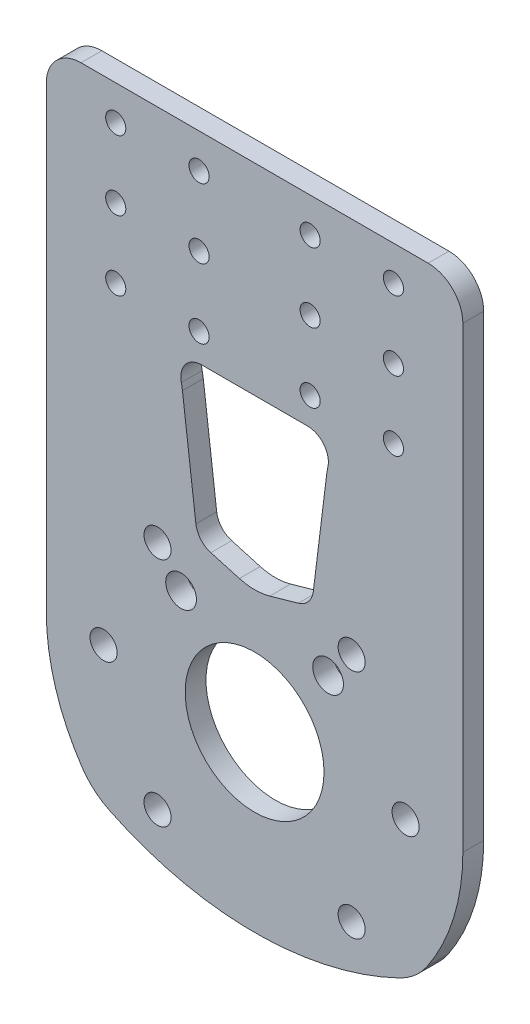
from build123d import *

# Parameters (mm, degrees)
SKETCH_1_R          = 1.45
EXTRUDE_1_DEPTH     = 3
SKETCH_3_R          = 1.95
CUT_EXTRUDE_2_DEPTH = 77.216796049
FILLET_1_R          = 5
SKETCH_4_R          = 10
CUT_EXTRUDE_3_DEPTH = 77.216796049
SKETCH_5_R          = 2.213245743
CUT_EXTRUDE_4_DEPTH = 77.216796049
FILLET_2_R          = 10
FILLET_3_R          = 3
FILLET_4_R          = 8


with BuildPart() as part:
    # 草图1 → 凸台-拉伸1 (new body)
    with BuildSketch(Plane.XY):
        with BuildLine():
            Line((-30, 31), (30, 31))
            Line((30, 31), (30, -40))
            ThreePointArc((30, -40), (0, -70), (-30, -40))
            Line((-30, -40), (-30, 31))
        make_face()
        with Locations((-20, 26)):
            Circle(SKETCH_1_R, mode=Mode.SUBTRACT)
        with Locations((-20, 16)):
            Circle(SKETCH_1_R, mode=Mode.SUBTRACT)
        with Locations((-20, 6)):
            Circle(SKETCH_1_R, mode=Mode.SUBTRACT)
        with Locations((-8, 26)):
            Circle(SKETCH_1_R, mode=Mode.SUBTRACT)
        with Locations((-8, 16)):
            Circle(SKETCH_1_R, mode=Mode.SUBTRACT)
        with Locations((-8, 6)):
            Circle(SKETCH_1_R, mode=Mode.SUBTRACT)
        with Locations(Location((8, 6, 0), (0, 0, 180))):
            Circle(SKETCH_1_R, mode=Mode.SUBTRACT)
        with Locations(Location((8, 16, 0), (0, 0, 180))):
            Circle(SKETCH_1_R, mode=Mode.SUBTRACT)
        with Locations(Location((8, 26, 0), (0, 0, 180))):
            Circle(SKETCH_1_R, mode=Mode.SUBTRACT)
        with Locations(Location((20, 6, 0), (0, 0, 180))):
            Circle(SKETCH_1_R, mode=Mode.SUBTRACT)
        with Locations(Location((20, 16, 0), (0, 0, 180))):
            Circle(SKETCH_1_R, mode=Mode.SUBTRACT)
        with Locations(Location((20, 26, 0), (0, 0, 180))):
            Circle(SKETCH_1_R, mode=Mode.SUBTRACT)
    extrude(amount=EXTRUDE_1_DEPTH)

    # 草图3 → 切除-拉伸2 (cut, through all)
    with BuildSketch(Plane.XY.offset(3)):
        with Locations((-21.75, -40)):
            Circle(SKETCH_3_R)
        with Locations((-13.980630511, -23.338533362)):
            Circle(SKETCH_3_R)
        with Locations((-13.980630511, -56.661466638)):
            Circle(SKETCH_3_R)
        with Locations((21.75, -40)):
            Circle(SKETCH_3_R)
        with Locations((13.980630511, -23.338533362)):
            Circle(SKETCH_3_R)
        with Locations((13.980630511, -56.661466638)):
            Circle(SKETCH_3_R)
    extrude(amount=-CUT_EXTRUDE_2_DEPTH, mode=Mode.SUBTRACT)

    # 圆角1
    fillet_1_edges = [part.edges().sort_by_distance(p)[0] for p in [
        (-30, 31, 1.5),
        (30, 31, 1.5),
    ]]
    fillet(fillet_1_edges, radius=FILLET_1_R)

    # 草图4 → 切除-拉伸3 (cut, through all)
    with BuildSketch(Plane.XY.offset(3)):
        with Locations((0, -40)):
            Circle(SKETCH_4_R)
    extrude(amount=-CUT_EXTRUDE_3_DEPTH, mode=Mode.SUBTRACT)

    # 草图5 → 切除-拉伸4 (cut, through all)
    with BuildSketch(Plane.XY.offset(3)):
        with Locations((-10.587343504, -27.656694111)):
            Circle(SKETCH_5_R)
        with Locations(Location((10.587343504, -27.656694111, 0), (0, 0, 180))):
            Circle(SKETCH_5_R)
        with BuildLine():
            Line((0, -22.555255147), (-8.212014753, -20.218285546))
            Line((-8.212014753, -20.218285546), (-10.389846713, -2.597786896))
            ThreePointArc((-10.389846713, -2.597786896), (-11.055900559, -0.155034313), (-12.38499612, 2))
            Line((-12.38499612, 2), (12.38499612, 2))
            ThreePointArc((12.38499612, 2), (11.055900559, -0.155034313), (10.389846713, -2.597786896))
            Line((10.389846713, -2.597786896), (8.212014753, -20.218285546))
            Line((8.212014753, -20.218285546), (0, -22.555255147))
        make_face()
        with BuildLine():
            ThreePointArc((-23.179978152, -59.044385338), (0, -64.997150083), (23.179978152, -59.044385338))
            ThreePointArc((23.179978152, -59.044385338), (0, -70), (-23.179978152, -59.044385338))
        make_face()
    extrude(amount=-CUT_EXTRUDE_4_DEPTH, mode=Mode.SUBTRACT)

    # 圆角2
    fillet_2_edges = [part.edges().sort_by_distance(p)[0] for p in [
        (23.179978152, -59.044385338, 1.5),
        (-23.179978152, -59.044385338, 1.5),
    ]]
    fillet(fillet_2_edges, radius=FILLET_2_R)

    # 圆角3
    fillet_3_edges = [part.edges().sort_by_distance(p)[0] for p in [
        (8.212014753, -20.218285546, 1.5),
        (-8.212014753, -20.218285546, 1.5),
        (-12.38499612, 2, 1.5),
        (12.38499612, 2, 1.5),
    ]]
    fillet(fillet_3_edges, radius=FILLET_3_R)

    # 圆角4
    fillet_4_edges = [part.edges().sort_by_distance(p)[0] for p in [
        (0, -22.555255147, 1.5),
    ]]
    fillet(fillet_4_edges, radius=FILLET_4_R)


solid = part.part
